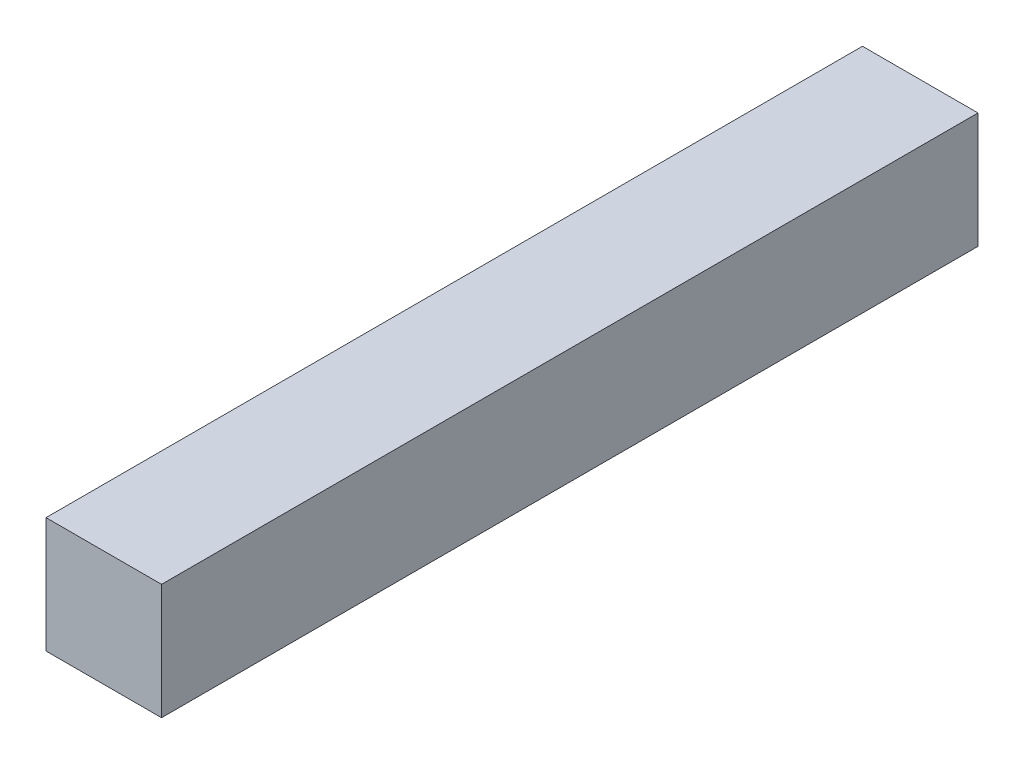
from build123d import *

# Parameters (mm, degrees)
SKETCH1_W      = 4.7625
SKETCH1_H      = 4.7625
EXTRUDE1_DEPTH = 33.655


with BuildPart() as part:
    # sketch1 → Extrude1 (new body)
    with BuildSketch(Plane.XY):
        Rectangle(SKETCH1_W, SKETCH1_H)
    extrude(amount=EXTRUDE1_DEPTH)


solid = part.part
